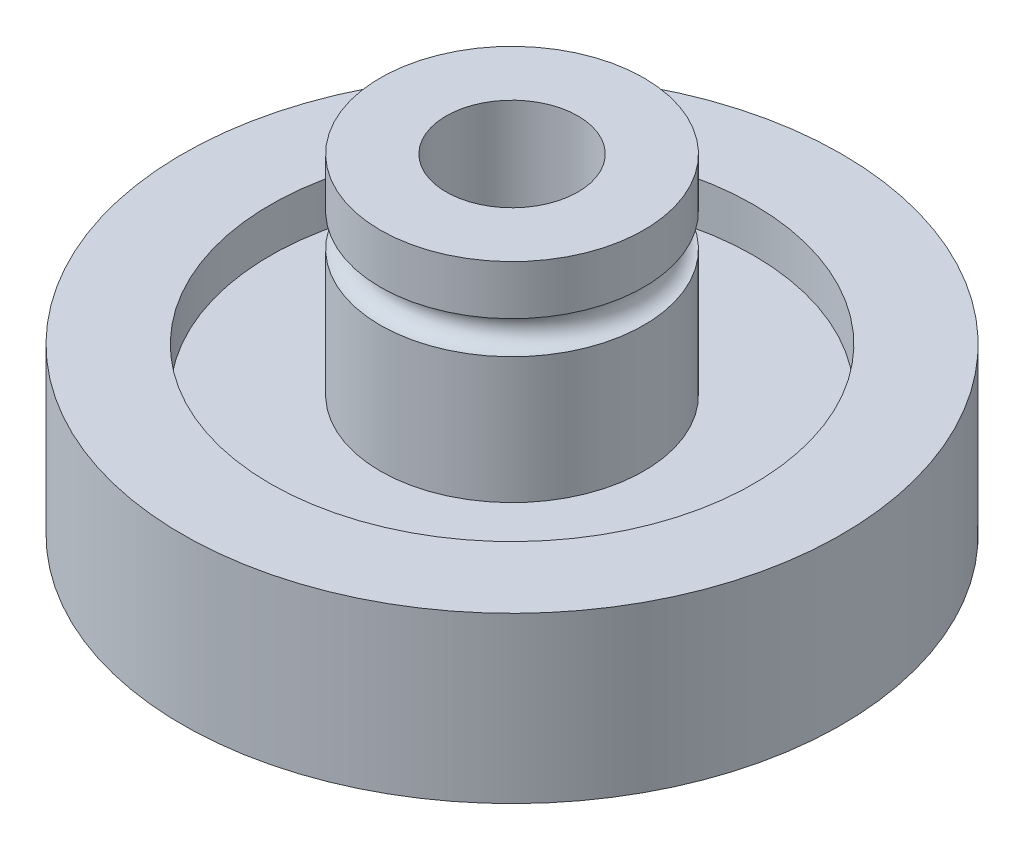
from build123d import *

# Parameters (mm, degrees)
SKETCH_2_R = 1.5
SKETCH_2_W = 10
SKETCH_2_H = 4


with BuildPart() as part:
    # 草图1 → 旋转1 (revolve)
    with BuildSketch(Plane.XY, mode=Mode.PRIVATE) as revolve_1_sk:
        Polygon((-12, 30), (-12, 15), (-30, 15), (-30, 0), (-6, 0), (-6, 30), align=None)
    revolve(revolve_1_sk.sketch.rotate(Axis((0, -28.507704651, 0), (0, 1, 0)), 270), axis=Axis((0, -28.507704651, 0), (0, 1, 0)))

    # 草图2 → 切除-旋转1 (revolve, cut)
    with BuildSketch(Plane.XY, mode=Mode.PRIVATE) as cut_revolve_1_sk:
        with Locations((-12, 24)):
            Circle(SKETCH_2_R)
        with Locations((-17, 13)):
            Rectangle(SKETCH_2_W, SKETCH_2_H)
        with Locations((-17, 2)):
            Rectangle(SKETCH_2_W, SKETCH_2_H)
    revolve(cut_revolve_1_sk.sketch.rotate(Axis((0, 0, 0), (0, 1, 0)), 270), axis=Axis((0, 0, 0), (0, 1, 0)), mode=Mode.SUBTRACT)


solid = part.part
